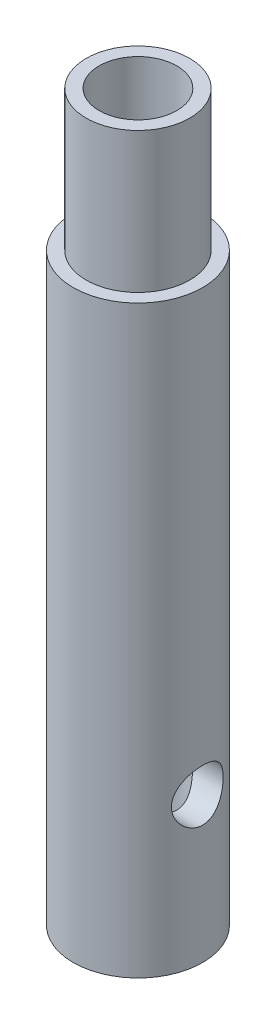
from build123d import *

# Parameters (mm, degrees)
ESBO_O1_R                = 12.5
RESSALTO_EXTRUS_O1_DEPTH = 112.9
ESBO_O2_R                = 10
RESSALTO_EXTRUS_O2_DEPTH = 27.1
ESBO_O3_R                = 7.5
CORTE_EXTRUS_O1_DEPTH    = 142.111657917
ESBO_O5_R                = 5
CORTE_EXTRUS_O2_DEPTH    = 15


with BuildPart() as part:
    # Esboço1 → Ressalto-extrusão1 (new body)
    with BuildSketch(Plane(origin=(0, 0, 0), x_dir=(1, 0, 0), z_dir=(0, 1, 0))):
        with Locations(Location((0, 0, 0), (0, 0, 90))):
            Circle(ESBO_O1_R)
    extrude(amount=RESSALTO_EXTRUS_O1_DEPTH)

    # Esboço2 → Ressalto-extrusão2 (add)
    with BuildSketch(Plane(origin=(0, 112.9, 0), x_dir=(1, 0, 0), z_dir=(0, 1, 0))):
        with Locations(Location((0, 0, 0), (0, 0, 90))):
            Circle(ESBO_O2_R)
    extrude(amount=RESSALTO_EXTRUS_O2_DEPTH)

    # Esboço3 → Corte-extrusão1 (cut, through all)
    with BuildSketch(Plane(origin=(0, 140, 0), x_dir=(1, 0, 0), z_dir=(0, 1, 0))):
        with Locations(Location((0, 0, 0), (0, 0, 270))):
            Circle(ESBO_O3_R)
    extrude(amount=-CORTE_EXTRUS_O1_DEPTH, mode=Mode.SUBTRACT)

    # Esboço5 → Corte-extrusão2 (cut, symmetric)
    with BuildSketch(Plane(origin=(0, 0, 0), x_dir=(0, 0, -1), z_dir=(1, 0, 0))):
        with Locations((0, 28)):
            Circle(ESBO_O5_R)
    extrude(amount=CORTE_EXTRUS_O2_DEPTH, both=True, mode=Mode.SUBTRACT)


solid = part.part
